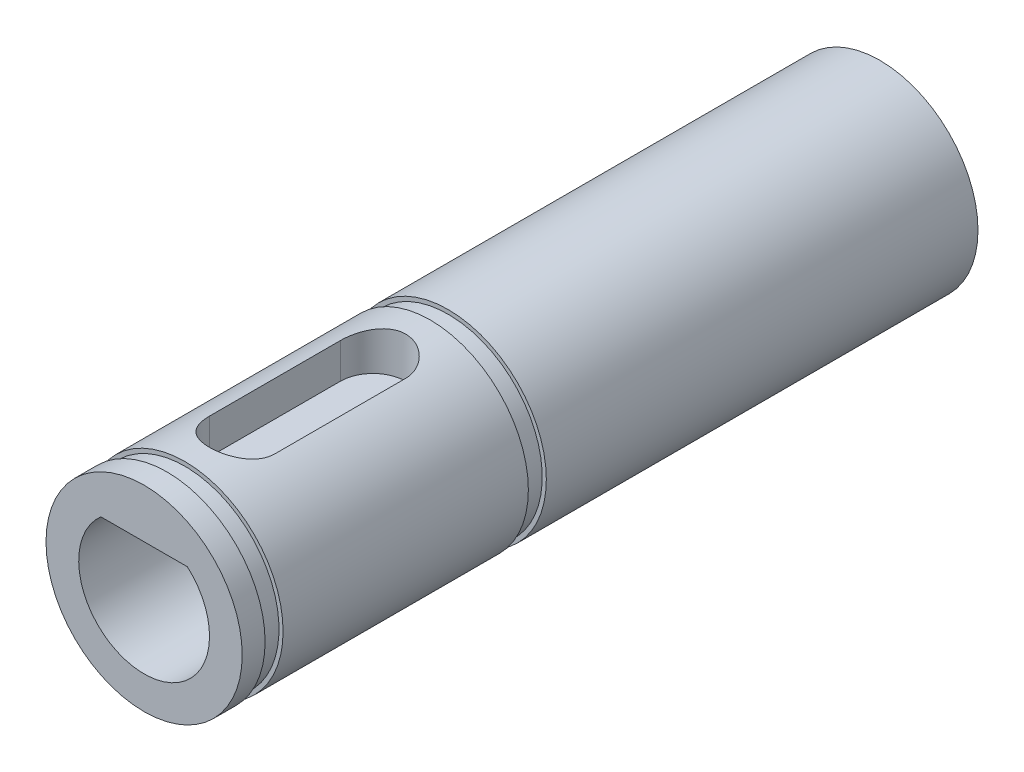
from build123d import *

# Parameters (mm, degrees)
ESBO_O1_R                = 6
RESSALTO_EXTRUS_O1_DEPTH = 45
CORTE_EXTRUS_O1_DEPTH    = 2.5
ESBO_O3_W                = 1.1
ESBO_O3_H                = 0.25


with BuildPart() as part:
    # Esboço1 → Ressalto-extrusão1 (new body)
    with BuildSketch(Plane.XY):
        with Locations(Location((0, 0, 0), (0, 0, 180))):
            Circle(ESBO_O1_R)
        with BuildLine():
            Line((-2.645751311, 3), (2.645751311, 3))
            ThreePointArc((2.645751311, 3), (0, -4), (-2.645751311, 3))
        make_face(mode=Mode.SUBTRACT)
    extrude(amount=RESSALTO_EXTRUS_O1_DEPTH)

    # Esboço2 → Corte-extrusão1 (cut)
    with BuildSketch(Plane(origin=(0, 6, 0), x_dir=(1, 0, 0), z_dir=(0, 1, 0))):
        with BuildLine():
            Line((-2, -39), (-2, -31))
            ThreePointArc((-2, -31), (0, -29), (2, -31))
            Line((2, -31), (2, -39))
            ThreePointArc((2, -39), (0, -41), (-2, -39))
        make_face()
    extrude(amount=-CORTE_EXTRUS_O1_DEPTH, mode=Mode.SUBTRACT)

    # Esboço3 → Corte-Revolução1 (revolve, cut)
    with BuildSketch(Plane(origin=(0, 0, 0), x_dir=(0, 0, -1), z_dir=(1, 0, 0)), mode=Mode.PRIVATE) as corte_revolu_o1_sk:
        with Locations((-26.95, 5.875)):
            Rectangle(ESBO_O3_W, ESBO_O3_H)
        with Locations((-43.05, 5.875)):
            Rectangle(ESBO_O3_W, ESBO_O3_H)
    revolve(corte_revolu_o1_sk.sketch.rotate(Axis((0, 0, 0), (0, 0, 1)), 90), axis=Axis((0, 0, 0), (0, 0, 1)), mode=Mode.SUBTRACT)


solid = part.part
